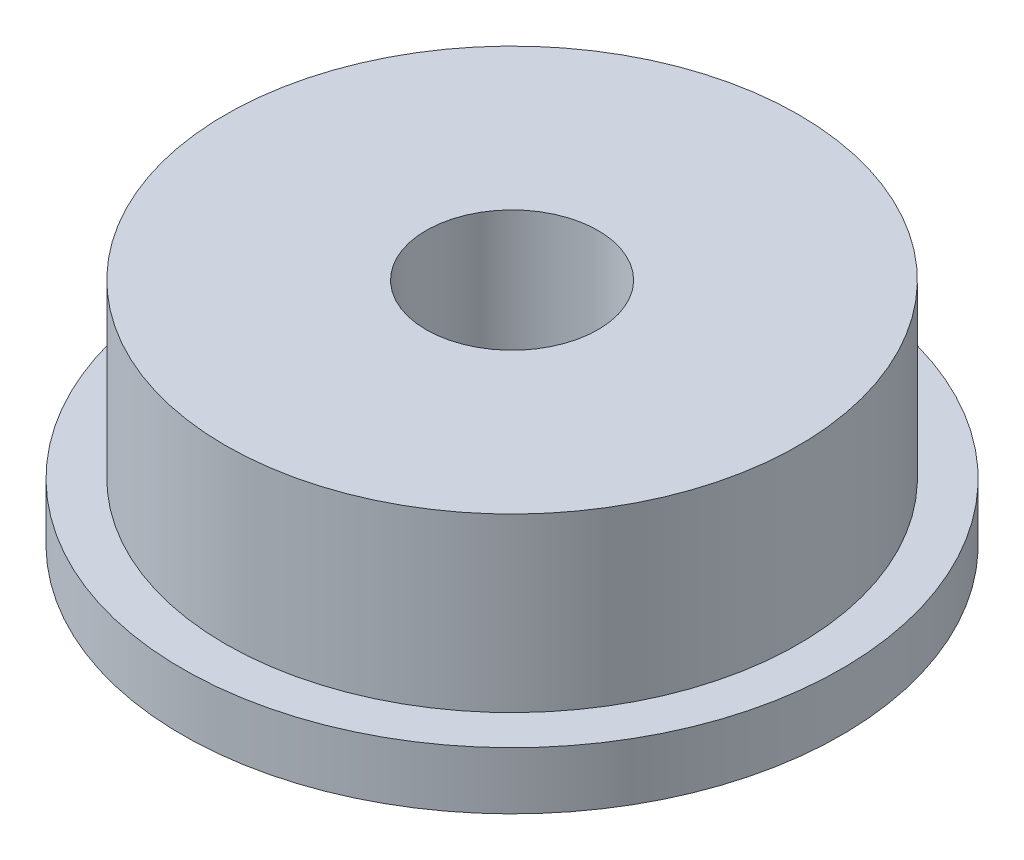
from build123d import *

# Parameters (mm, degrees)
ESBO_O1_R                = 5
RESSALTO_EXTRUS_O1_DEPTH = 4
ESBO_O3_R                = 5.75
RESSALTO_EXTRUS_O2_DEPTH = 1
ESBO_O2_R                = 1.5
CORTE_EXTRUS_O1_DEPTH    = 4


with BuildPart() as part:
    # Esboço1 → Ressalto-extrusão1 (new body)
    with BuildSketch(Plane(origin=(0, 0, 0), x_dir=(1, 0, 0), z_dir=(0, 1, 0))):
        with Locations(Location((0, 0, 0), (0, 0, 270))):
            Circle(ESBO_O1_R)
    extrude(amount=RESSALTO_EXTRUS_O1_DEPTH)

    # Esboço3 → Ressalto-extrusão2 (add)
    with BuildSketch(Plane.XZ):
        with Locations(Location((0, 0, 0), (0, 0, 270))):
            Circle(ESBO_O3_R)
    extrude(amount=-RESSALTO_EXTRUS_O2_DEPTH)

    # Esboço2 → Corte-extrusão1 (cut)
    with BuildSketch(Plane(origin=(0, 4, 0), x_dir=(1, 0, 0), z_dir=(0, 1, 0))):
        with Locations(Location((0, 0, 0), (0, 0, 270))):
            Circle(ESBO_O2_R)
    extrude(amount=-CORTE_EXTRUS_O1_DEPTH, mode=Mode.SUBTRACT)


solid = part.part
